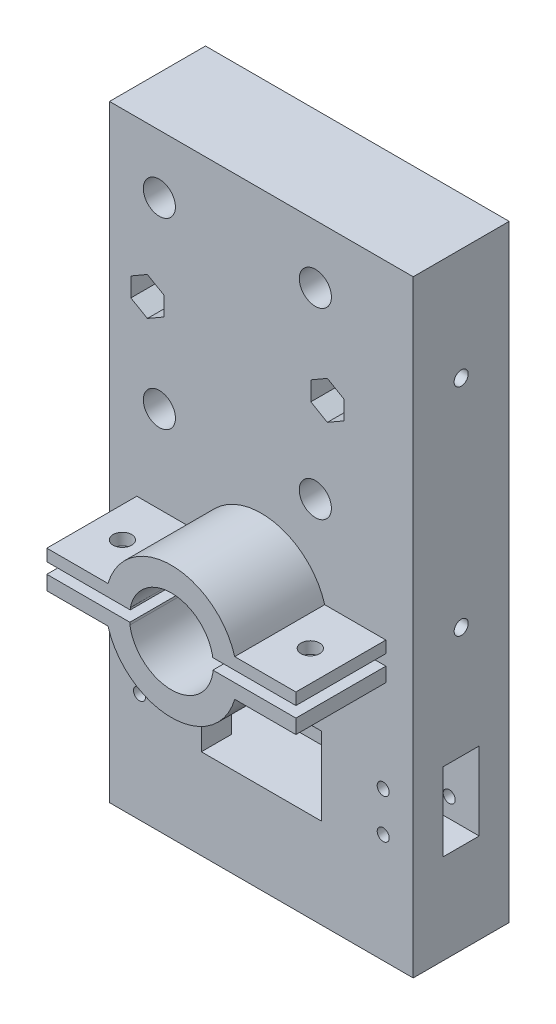
from build123d import *

# Parameters (mm, degrees)
SKETCH1_W               = 42.62295082
SKETCH1_H               = 50
SKETCH1_R               = 2.677018134
BOSS_EXTRUDE1_DEPTH     = 16
SKETCH2_R               = 11.04
CUT_EXTRUDE2_DEPTH      = 11
SKETCH3_R               = 1.75
CUT_EXTRUDE3_DEPTH      = 10
CUT_EXTRUDE6_START      = -5
CUT_EXTRUDE6_DEPTH      = 32.540101042
SKETCH30_W              = 42.62295082
SKETCH30_H              = 16
BOSS_EXTRUDE8_DEPTH     = 20.23
SKETCH10_W              = 42.62295082
SKETCH10_H              = 16
BOSS_EXTRUDE2_DEPTH     = 16
SKETCH14_W              = 6
SKETCH14_H              = 13
CUT_EXTRUDE7_DEPTH      = 77.300909802
BOSS_EXTRUDE3_DEPTH     = 8
CUT_EXTRUDE9_DEPTH      = 8
SKETCH18_W              = 0.9
SKETCH18_H              = 4
SKETCH18_W_2            = 1.8
CUT_EXTRUDE10_DEPTH     = 10.2
CUT_EXTRUDE8_DEPTH      = 70.744358128
CUT_EXTRUDE8_DEPTH_BACK = 70.744358128
SKETCH15_R              = 1
CUT_EXTRUDE5_DEPTH      = 81.484753157
CUT_EXTRUDE5_DEPTH_BACK = 50
SKETCH6_W               = 9.034037672
SKETCH6_H               = 3.85
SKETCH20_W              = 8
SKETCH20_H              = 16
BOSS_EXTRUDE5_DEPTH     = 13
SKETCH21_W              = 8
SKETCH21_H              = 6
CUT_EXTRUDE11_DEPTH     = 13
SKETCH22_R              = 1
CUT_EXTRUDE12_DEPTH     = 70.744358128
SKETCH24_W              = 50.62295082
SKETCH24_H              = 5
BOSS_EXTRUDE6_DEPTH     = 15
SKETCH25_W              = 50.62295082
SKETCH25_H              = 15
BOSS_EXTRUDE7_DEPTH     = 11
SKETCH26_R              = 1
CUT_EXTRUDE13_DEPTH     = 10
SKETCH27_W              = 4
SKETCH27_H              = 1.8
CUT_EXTRUDE14_DEPTH     = 10.2
SKETCH29_W              = 20
SKETCH29_H              = 3.2
CUT_EXTRUDE15_DEPTH     = 5
SKETCH31_W              = 9
SKETCH31_H              = 6
CUT_EXTRUDE16_DEPTH     = 11
BOSS_EXTRUDE9_DEPTH     = 15
SKETCH35_R              = 7
CUT_EXTRUDE17_DEPTH     = 84.223647425
SKETCH46_R              = 1.55
CUT_EXTRUDE29_DEPTH     = 110.852972152


with BuildPart() as part:
    # Sketch1 → Boss-Extrude1 (new body)
    with BuildSketch(Plane.XY):
        Rectangle(SKETCH1_W, SKETCH1_H)
        with Locations((-13, -15.25)):
            Circle(SKETCH1_R, mode=Mode.SUBTRACT)
        with Locations(Location((13, -15.25, 0), (0, 0, 180))):
            Circle(SKETCH1_R, mode=Mode.SUBTRACT)
        with Locations((13, 15.25)):
            Circle(SKETCH1_R, mode=Mode.SUBTRACT)
        with Locations(Location((-13, 15.25, 0), (0, 0, 180))):
            Circle(SKETCH1_R, mode=Mode.SUBTRACT)
    extrude(amount=BOSS_EXTRUDE1_DEPTH)

    # Sketch2 → Cut-Extrude2 (cut)
    with BuildSketch(Plane.XY):
        Circle(SKETCH2_R)
    extrude(amount=CUT_EXTRUDE2_DEPTH, mode=Mode.SUBTRACT)

    # Sketch3 → Cut-Extrude3 (cut)
    with BuildSketch(Plane(origin=(0, 0, 0), x_dir=(-1, 0, 0), z_dir=(0, 0, -1))):
        with Locations((-15, 0)):
            Circle(SKETCH3_R)
        with Locations(Location((15, 0, 0), (0, 0, 180))):
            Circle(SKETCH3_R)
    extrude(amount=-CUT_EXTRUDE3_DEPTH, mode=Mode.SUBTRACT)

    # Sketch9 → Cut-Extrude6 (cut, through all)
    with BuildSketch(Plane(origin=(0, 0, 0), x_dir=(-1, 0, 0), z_dir=(0, 0, -1)).offset(CUT_EXTRUDE6_START)):
        Polygon((-15, 3.175426481), (-17.75, 1.58771324), (-17.75, -1.58771324), (-15, -3.175426481), (-12.25, -1.58771324), (-12.25, 1.58771324), align=None)
        Polygon((12.25, 1.58771324), (15, 3.175426481), (17.75, 1.58771324), (17.75, -1.58771324), (15, -3.175426481), (12.25, -1.58771324), align=None)
    extrude(amount=-CUT_EXTRUDE6_DEPTH, mode=Mode.SUBTRACT)

    # Sketch30 → Boss-Extrude8 (add)
    with BuildSketch(Plane.XZ.offset(25)):
        with Locations((0, 8)):
            Rectangle(SKETCH30_W, SKETCH30_H)
    extrude(amount=BOSS_EXTRUDE8_DEPTH)

    # Sketch10 → Boss-Extrude2 (add)
    with BuildSketch(Plane.XY):
        with Locations((0, -53.23)):
            Rectangle(SKETCH10_W, SKETCH10_H)
    extrude(amount=BOSS_EXTRUDE2_DEPTH)

    # Sketch14 → Cut-Extrude7 (cut, through all)
    with BuildSketch(Plane.ZY.offset(21.31147541)):
        with Locations((8, -54.73)):
            Rectangle(SKETCH14_W, SKETCH14_H)
    extrude(amount=-CUT_EXTRUDE7_DEPTH, mode=Mode.SUBTRACT)

    # Sketch16 → Boss-Extrude3 (add)
    with BuildSketch(Plane(origin=(21.31147541, 0, 0), x_dir=(0, 0, -1), z_dir=(1, 0, 0))):
        Polygon((-11, -48.23), (-8, -48.23), (-8, 25), (-16, 25), (-16, -48.23), align=None)
        Polygon((-8, 25), (-8, -48.23), (-5, -48.23), (0, -48.23), (0, 25), align=None)
    extrude(amount=BOSS_EXTRUDE3_DEPTH)

    # Sketch17 → Cut-Extrude9 (cut)
    with BuildSketch(Plane(origin=(29.31147541, 0, 0), x_dir=(0, 0, -1), z_dir=(1, 0, 0))):
        with BuildLine():
            ThreePointArc((-8, 7.56), (-9.175, 6.385), (-8, 5.21))
            Line((-8, 5.21), (-8, 7.56))
        make_face()
        with BuildLine():
            Line((-8, 7.56), (-8, 5.21))
            ThreePointArc((-8, 5.21), (-7.169149532, 5.554149532), (-6.825, 6.385))
            ThreePointArc((-6.825, 6.385), (-7.169149532, 7.215850468), (-8, 7.56))
        make_face()
        with BuildLine():
            ThreePointArc((-8, -28.44), (-9.175, -29.615), (-8, -30.79))
            Line((-8, -30.79), (-8, -28.44))
        make_face()
        with BuildLine():
            Line((-8, -28.44), (-8, -30.79))
            ThreePointArc((-8, -30.79), (-7.169149532, -30.445850468), (-6.825, -29.615))
            ThreePointArc((-6.825, -29.615), (-7.169149532, -28.784149532), (-8, -28.44))
        make_face()
    extrude(amount=-CUT_EXTRUDE9_DEPTH, mode=Mode.SUBTRACT)

    # Sketch18 → Cut-Extrude10 (cut)
    with BuildSketch(Plane(origin=(0, 0, 0), x_dir=(-1, 0, 0), z_dir=(0, 0, -1))):
        with Locations((-24.86147541, 6.385)):
            Rectangle(SKETCH18_W, SKETCH18_H)
        with Locations((-25.76147541, 6.385)):
            Rectangle(SKETCH18_W, SKETCH18_H)
        with Locations((-25.31147541, -29.615)):
            Rectangle(SKETCH18_W_2, SKETCH18_H)
    extrude(amount=-CUT_EXTRUDE10_DEPTH, mode=Mode.SUBTRACT)

    # Sketch15 → Cut-Extrude8 (cut, two sides: drawn at the far end of the back side and taken through both)
    with BuildSketch(Plane(origin=(0, 0, 0), x_dir=(-1, 0, 0), z_dir=(0, 0, -1)).offset(-CUT_EXTRUDE8_DEPTH_BACK)):
        with Locations(Location((16.31147541, -58.03, 0), (0, 0, 270))):
            Circle(SKETCH15_R)
        with Locations((16.31147541, -51.43)):
            Circle(SKETCH15_R)
    extrude(amount=CUT_EXTRUDE8_DEPTH + CUT_EXTRUDE8_DEPTH_BACK, mode=Mode.SUBTRACT)

    # Sketch6 → Cut-Extrude5 (cut, two sides: drawn at the far end of the back side and taken through both)
    with BuildSketch(Plane.XZ.offset(48.23).offset(-CUT_EXTRUDE5_DEPTH_BACK)):
        with Locations((0, 12.925)):
            Rectangle(SKETCH6_W, SKETCH6_H)
    extrude(amount=CUT_EXTRUDE5_DEPTH + CUT_EXTRUDE5_DEPTH_BACK, mode=Mode.SUBTRACT)

    # Sketch20 → Boss-Extrude5 (add)
    with BuildSketch(Plane(origin=(0, -48.23, 0), x_dir=(-1, 0, 0), z_dir=(0, -1, 0))):
        with Locations((-25.31147541, -8)):
            Rectangle(SKETCH20_W, SKETCH20_H)
    extrude(amount=BOSS_EXTRUDE5_DEPTH)

    # Sketch21 → Cut-Extrude11 (cut)
    with BuildSketch(Plane(origin=(0, -61.23, 0), x_dir=(-1, 0, 0), z_dir=(0, -1, 0))):
        with Locations((-25.31147541, -8)):
            Rectangle(SKETCH21_W, SKETCH21_H)
    extrude(amount=-CUT_EXTRUDE11_DEPTH, mode=Mode.SUBTRACT)

    # Sketch22 → Cut-Extrude12 (cut, through all)
    with BuildSketch(Plane(origin=(0, 0, 0), x_dir=(-1, 0, 0), z_dir=(0, 0, -1))):
        with Locations((-24.31147541, -58.03)):
            Circle(SKETCH22_R)
        with Locations((-24.31147541, -51.43)):
            Circle(SKETCH22_R)
    extrude(amount=-CUT_EXTRUDE12_DEPTH, mode=Mode.SUBTRACT)

    # Sketch24 → Boss-Extrude6 (add)
    with BuildSketch(Plane.XZ.offset(61.23)):
        with Locations((4, 2.5)):
            Rectangle(SKETCH24_W, SKETCH24_H)
    extrude(amount=BOSS_EXTRUDE6_DEPTH)

    # Sketch25 → Boss-Extrude7 (add)
    with BuildSketch(Plane.XY.offset(5)):
        with Locations((4, -68.73)):
            Rectangle(SKETCH25_W, SKETCH25_H)
    extrude(amount=BOSS_EXTRUDE7_DEPTH)

    # Sketch26 → Cut-Extrude13 (cut)
    with BuildSketch(Plane.XZ.offset(76.23)):
        with BuildLine():
            ThreePointArc((-15, 8), (-14, 7), (-13, 8))
            Line((-13, 8), (-15, 8))
        make_face()
        with BuildLine():
            Line((-15, 8), (-13, 8))
            ThreePointArc((-13, 8), (-14, 9), (-15, 8))
        make_face()
        with Locations(Location((22, 8, 0), (0, 0, 270))):
            Circle(SKETCH26_R)
    extrude(amount=-CUT_EXTRUDE13_DEPTH, mode=Mode.SUBTRACT)

    # Sketch27 → Cut-Extrude14 (cut)
    with BuildSketch(Plane(origin=(0, 0, 0), x_dir=(-1, 0, 0), z_dir=(0, 0, -1))):
        with Locations((-22.00147541, -72.23)):
            Rectangle(SKETCH27_W, SKETCH27_H)
        with Locations((14.00147541, -72.23)):
            Rectangle(SKETCH27_W, SKETCH27_H)
    extrude(amount=-CUT_EXTRUDE14_DEPTH, mode=Mode.SUBTRACT)

    # Sketch29 → Cut-Extrude15 (cut)
    with BuildSketch(Plane.XY.offset(16)):
        with Locations((4, -49.83)):
            Rectangle(SKETCH29_W, SKETCH29_H)
        Polygon((-6, -51.43), (-6, -53.105302663), (4, -54.73), (14, -53.105302663), (14, -51.43), align=None)
        Polygon((4, -54.73), (-6, -53.105302663), (-6, -56.354697337), align=None)
        with Locations((4, -59.63)):
            Rectangle(SKETCH29_W, SKETCH29_H)
        Polygon((14, -56.354697337), (4, -54.73), (-6, -56.354697337), (-6, -58.03), (14, -58.03), align=None)
        Polygon((14, -53.105302663), (4, -54.73), (14, -56.354697337), align=None)
    extrude(amount=-CUT_EXTRUDE15_DEPTH, mode=Mode.SUBTRACT)

    # Sketch31 → Cut-Extrude16 (cut)
    with BuildSketch(Plane(origin=(0, 0, 0), x_dir=(-1, 0, 0), z_dir=(0, 0, -1))):
        with Locations((0, 11.04)):
            Rectangle(SKETCH31_W, SKETCH31_H)
        with Locations((0, -11.04)):
            Rectangle(SKETCH31_W, SKETCH31_H)
    extrude(amount=-CUT_EXTRUDE16_DEPTH, mode=Mode.SUBTRACT)

    # Sketch32 → Boss-Extrude9 (add)
    with BuildSketch(Plane.XY.offset(16)):
        with BuildLine():
            Line((14.559434578, -29.715168312), (24.758563733, -29.715168312))
            Line((24.758563733, -29.715168312), (24.758563733, -31.680835322))
            Line((24.758563733, -31.680835322), (22.349807475, -31.680835322))
            Line((22.349807475, -31.680835322), (10.859237198, -31.680835322))
            Line((10.859237198, -31.680835322), (10.849807475, -31.356803512))
            ThreePointArc((10.849807475, -31.356803512), (3.99852459, -25.792046638), (-2.852758295, -31.356803512))
            Line((-2.852758295, -31.356803512), (-2.852758295, -31.680835322))
            Line((-2.852758295, -31.680835322), (-14.352758295, -31.680835322))
            Line((-14.352758295, -31.680835322), (-16.761514553, -31.680835322))
            Line((-16.761514553, -31.680835322), (-16.761514553, -29.715168312))
            Line((-16.761514553, -29.715168312), (-6.562385398, -29.715168312))
            ThreePointArc((-6.562385398, -29.715168312), (3.99852459, -21.792046638), (14.559434578, -29.715168312))
        make_face()
        with BuildLine():
            Line((-14.352758295, -33.483822891), (-2.914657165, -33.483822891))
            Line((-2.914657165, -33.483822891), (-2.914657165, -33.891099874))
            ThreePointArc((-2.914657165, -33.891099874), (3.99852459, -39.792046638), (10.911706346, -33.891099874))
            Line((10.911706346, -33.891099874), (10.911706346, -33.483822891))
            Line((10.911706346, -33.483822891), (22.349807475, -33.483822891))
            Line((22.349807475, -33.483822891), (24.758563733, -33.483822891))
            Line((24.758563733, -33.483822891), (24.758563733, -35.868924963))
            Line((24.758563733, -35.868924963), (14.559434578, -35.868924963))
            ThreePointArc((14.559434578, -35.868924963), (3.99852459, -43.792046638), (-6.562385398, -35.868924963))
            Line((-6.562385398, -35.868924963), (-16.761514553, -35.868924963))
            Line((-16.761514553, -35.868924963), (-16.761514553, -33.483822891))
            Line((-16.761514553, -33.483822891), (-14.352758295, -33.483822891))
        make_face()
    extrude(amount=BOSS_EXTRUDE9_DEPTH)

    # Sketch35 → Cut-Extrude17 (cut, through all)
    with BuildSketch(Plane.XY.offset(16)):
        with Locations(Location((3.99852459, -32.792046638, 0), (0, 0, 185.671523081))):
            Circle(SKETCH35_R)
    extrude(amount=-CUT_EXTRUDE17_DEPTH, mode=Mode.SUBTRACT)

    # Sketch46 → Cut-Extrude29 (cut, through all)
    with BuildSketch(Plane.XZ.offset(76.23)):
        with Locations(Location((-11.661514553, 23.5, 0), (0, 0, 270))):
            Circle(SKETCH46_R)
        with Locations(Location((19.658563733, 23.5, 0), (0, 0, 270))):
            Circle(SKETCH46_R)
    extrude(amount=-CUT_EXTRUDE29_DEPTH, mode=Mode.SUBTRACT)


solid = part.part
